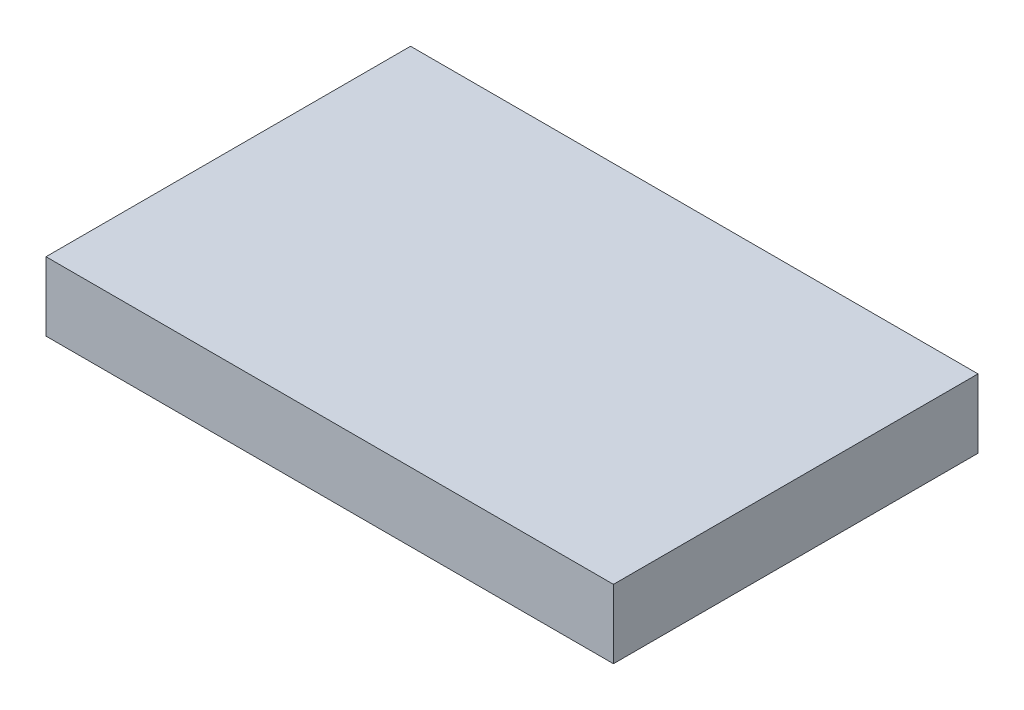
from build123d import *

# Parameters (mm, degrees)
SZKIC1_W                    = 82.5
SZKIC1_H                    = 53
DODANIE_WYCI_GNI_CIE1_DEPTH = 10


with BuildPart() as part:
    # Szkic1 → Dodanie-wyciągnięcie1 (new body)
    with BuildSketch(Plane(origin=(0, 0, 0), x_dir=(1, 0, 0), z_dir=(0, 1, 0))):
        Rectangle(SZKIC1_W, SZKIC1_H)
    extrude(amount=DODANIE_WYCI_GNI_CIE1_DEPTH)


solid = part.part
